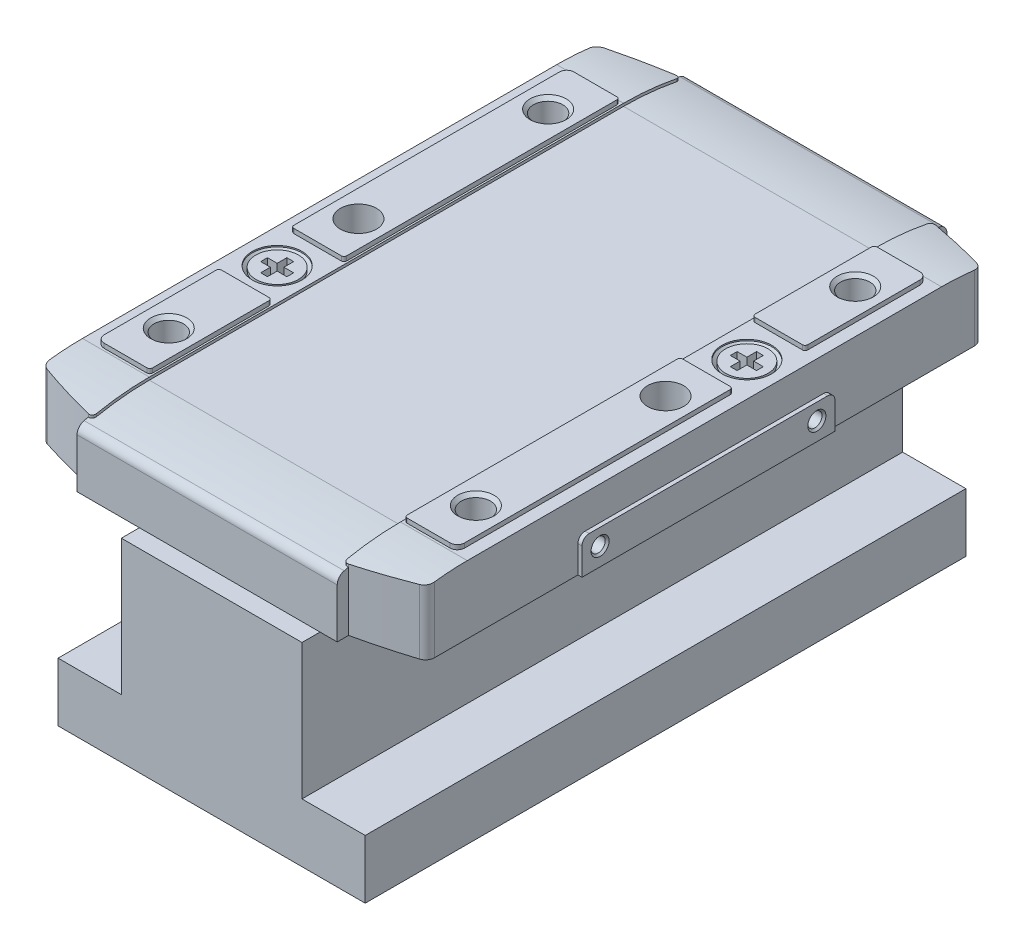
from build123d import *

# Parameters (mm, degrees)
BOSS_EXTRUDE1_DEPTH      = 33.25
BOSS_EXTRUDE1_DEPTH_BACK = 33.25
BOSS_EXTRUDE2_DEPTH      = 20
BOSS_EXTRUDE2_DEPTH_BACK = 20
SKETCH2_W                = 16
SKETCH2_H                = 2.94
BOSS_EXTRUDE3_DEPTH      = 5
BOSS_EXTRUDE4_DEPTH      = 5
BOSS_EXTRUDE5_DEPTH      = 12.5
BOSS_EXTRUDE5_DEPTH_BACK = 12.5
BOSS_EXTRUDE6_DEPTH      = 12.5
BOSS_EXTRUDE6_DEPTH_BACK = 12.5
CUT_EXTRUDE1_DEPTH       = 33.75
CUT_EXTRUDE1_DEPTH_BACK  = 33.75
SKETCH7_W                = 26
SKETCH7_H                = 0.1
BOSS_EXTRUDE7_DEPTH      = 14.4
BOSS_EXTRUDE7_DEPTH_BACK = 14.4
BOSS_EXTRUDE8_DEPTH      = 7.5
BOSS_EXTRUDE9_DEPTH      = 7.5
CUT_EXTRUDE2_DEPTH       = 30
CUT_EXTRUDE2_DEPTH_BACK  = 30
BOSS_EXTRUDE10_DEPTH     = 5
BOSS_EXTRUDE11_DEPTH     = 5
BOSS_EXTRUDE12_DEPTH     = 5
BOSS_EXTRUDE13_DEPTH     = 5
SKETCH16_W               = 2
SKETCH16_H               = 3.1
LPATTERN1_COUNT          = 2
LPATTERN1_PITCH          = 34
LPATTERN2_COUNT          = 2
LPATTERN2_PITCH          = 42
LPATTERN3_COUNT          = 2
LPATTERN3_PITCH          = 42
BOSS_EXTRUDE14_DEPTH     = 0.45
BOSS_EXTRUDE15_START     = -0.45
BOSS_EXTRUDE15_DEPTH     = 0.45
LPATTERN4_COUNT          = 2
LPATTERN4_PITCH          = 24
LPATTERN5_COUNT          = 2
LPATTERN5_PITCH          = 24
CUT_EXTRUDE3_DEPTH       = 0.375
CUT_EXTRUDE3_DEPTH_BACK  = 0.375
SKETCH29_W               = 2.9
SKETCH29_H               = 1.7
CUT_EXTRUDE4_DEPTH       = 0.375
CUT_EXTRUDE4_DEPTH_BACK  = 0.375
SKETCH30_W               = 2.9
SKETCH30_H               = 1.7
CUT_EXTRUDE5_DEPTH       = 0.375
CUT_EXTRUDE5_DEPTH_BACK  = 0.375
SKETCH32_W               = 2.9
SKETCH32_H               = 1.7
CUT_EXTRUDE6_DEPTH       = 0.375
CUT_EXTRUDE6_DEPTH_BACK  = 0.375
SKETCH33_W               = 2.9
SKETCH33_H               = 1.7


with BuildPart() as part:
    # Sketch1 → Boss-Extrude1 (new, two sides: drawn at the far end of the back side and taken through both)
    with BuildSketch(Plane.XY.offset(-BOSS_EXTRUDE1_DEPTH_BACK)):
        Polygon((-17, 6.5), (-17, 0), (17, 0), (17, 6.5), (10, 6.5), (10, 21.5), (-10, 21.5), (-10, 6.5), align=None)
    extrude(amount=BOSS_EXTRUDE1_DEPTH + BOSS_EXTRUDE1_DEPTH_BACK)

    # Sketch2 → Boss-Extrude2 (add, two sides: drawn at the far end of the back side and taken through both)
    with BuildSketch(Plane.XY.offset(-BOSS_EXTRUDE2_DEPTH_BACK)):
        with Locations((0, 22.97)):
            Rectangle(SKETCH2_W, SKETCH2_H)
    extrude(amount=BOSS_EXTRUDE2_DEPTH + BOSS_EXTRUDE2_DEPTH_BACK)

    # Sketch3 → Boss-Extrude3 (add)
    with BuildSketch(Plane.XY.offset(28.75)):
        Polygon((-13.4, 22.4), (-8, 22.4), (-8, 21.5), (8, 21.5), (8, 22.4), (13.4, 22.4), (13.4, 22.85), (-13.4, 22.85), align=None)
    extrude(amount=-BOSS_EXTRUDE3_DEPTH)

    # Sketch4 → Boss-Extrude4 (add)
    with BuildSketch(Plane.XY.offset(-28.75)):
        Polygon((-13.4, 22.4), (-8, 22.4), (-8, 21.5), (8, 21.5), (8, 22.4), (13.4, 22.4), (13.4, 22.85), (-13.4, 22.85), align=None)
    extrude(amount=BOSS_EXTRUDE4_DEPTH)

    # Sketch5 → Boss-Extrude5 (add, two sides: drawn at the far end of the back side and taken through both)
    with BuildSketch(Plane(origin=(0, 0, 0), x_dir=(0, 0, -1), z_dir=(1, 0, 0)).offset(-BOSS_EXTRUDE5_DEPTH_BACK)):
        with BuildLine():
            Line((28.75, 22.66), (28.75, 24.44))
            ThreePointArc((28.75, 24.44), (23.724272164, 24.990406715), (18.936803962, 26.615533185))
            Line((18.936803962, 26.615533185), (18.184543456, 25.002305324))
            ThreePointArc((18.184543456, 25.002305324), (23.339009652, 23.252599822), (28.75, 22.66))
        make_face()
    extrude(amount=BOSS_EXTRUDE5_DEPTH + BOSS_EXTRUDE5_DEPTH_BACK)

    # Sketch6 → Boss-Extrude6 (add, two sides: drawn at the far end of the back side and taken through both)
    with BuildSketch(Plane(origin=(0, 0, 0), x_dir=(0, 0, -1), z_dir=(1, 0, 0)).offset(-BOSS_EXTRUDE6_DEPTH_BACK)):
        with BuildLine():
            Line((-18.184543456, 25.002305324), (-18.936803962, 26.615533185))
            ThreePointArc((-18.936803962, 26.615533185), (-23.724272164, 24.990406715), (-28.75, 24.44))
            Line((-28.75, 24.44), (-28.75, 22.66))
            ThreePointArc((-28.75, 22.66), (-23.339009652, 23.252599822), (-18.184543456, 25.002305324))
        make_face()
    extrude(amount=BOSS_EXTRUDE6_DEPTH + BOSS_EXTRUDE6_DEPTH_BACK)

    # Sketch7 → Cut-Extrude1 (cut, two sides: drawn at the far end of the back side and taken through both)
    with BuildSketch(Plane.XY.offset(-CUT_EXTRUDE1_DEPTH_BACK)):
        with Locations((0, 22.61)):
            Rectangle(SKETCH7_W, SKETCH7_H)
    extrude(amount=CUT_EXTRUDE1_DEPTH + CUT_EXTRUDE1_DEPTH_BACK, mode=Mode.SUBTRACT)

    # Sketch8 → Boss-Extrude7 (add, two sides: drawn at the far end of the back side and taken through both)
    with BuildSketch(Plane(origin=(0, 0, 0), x_dir=(0, 0, -1), z_dir=(1, 0, 0)).offset(-BOSS_EXTRUDE7_DEPTH_BACK)):
        with BuildLine():
            Line((-33.75, 29.462165522), (-33.75, 24))
            Line((-33.75, 24), (33.75, 24))
            Line((33.75, 24), (33.75, 29.462165522))
            ThreePointArc((33.75, 29.462165522), (33.532348366, 30.085006621), (32.974137931, 30.436722954))
            ThreePointArc((32.974137931, 30.436722954), (29.633660103, 31.008569981), (26.25, 31.2))
            Line((26.25, 31.2), (-26.25, 31.2))
            ThreePointArc((-26.25, 31.2), (-29.633660103, 31.008569981), (-32.974137931, 30.436722954))
            ThreePointArc((-32.974137931, 30.436722954), (-33.532348366, 30.085006621), (-33.75, 29.462165522))
        make_face()
    extrude(amount=BOSS_EXTRUDE7_DEPTH + BOSS_EXTRUDE7_DEPTH_BACK)

    # Sketch9 → Boss-Extrude8 (add)
    with BuildSketch(Plane(origin=(0, 24, 0), x_dir=(1, 0, 0), z_dir=(0, 1, 0))):
        with BuildLine():
            Line((21.3, -29.875824116), (21.3, 29.875824116))
            ThreePointArc((21.3, 29.875824116), (21.107856162, 30.465203808), (20.605263158, 30.828092148))
            ThreePointArc((20.605263158, 30.828092148), (17.515198934, 31.737942185), (14.385245902, 32.499334343))
            ThreePointArc((14.385245902, 32.499334343), (14.049099981, 32.420050648), (13.9, 32.108523473))
            Line((13.9, 32.108523473), (13.9, -32.108523473))
            ThreePointArc((13.9, -32.108523473), (14.049099981, -32.420050648), (14.385245902, -32.499334343))
            ThreePointArc((14.385245902, -32.499334343), (17.515198934, -31.737942185), (20.605263158, -30.828092148))
            ThreePointArc((20.605263158, -30.828092148), (21.107856162, -30.465203808), (21.3, -29.875824116))
        make_face()
    extrude(amount=BOSS_EXTRUDE8_DEPTH)

    # Sketch10 → Boss-Extrude9 (add)
    with BuildSketch(Plane(origin=(0, 24, 0), x_dir=(1, 0, 0), z_dir=(0, 1, 0))):
        with BuildLine():
            Line((-21.3, 29.875824116), (-21.3, -29.875824116))
            ThreePointArc((-21.3, -29.875824116), (-21.107856162, -30.465203808), (-20.605263158, -30.828092148))
            ThreePointArc((-20.605263158, -30.828092148), (-17.515198934, -31.737942185), (-14.385245902, -32.499334343))
            ThreePointArc((-14.385245902, -32.499334343), (-14.049099981, -32.420050648), (-13.9, -32.108523473))
            Line((-13.9, -32.108523473), (-13.9, 32.108523473))
            ThreePointArc((-13.9, 32.108523473), (-14.049099981, 32.420050648), (-14.385245902, 32.499334343))
            ThreePointArc((-14.385245902, 32.499334343), (-17.515198934, 31.737942185), (-20.605263158, 30.828092148))
            ThreePointArc((-20.605263158, 30.828092148), (-21.107856162, 30.465203808), (-21.3, 29.875824116))
        make_face()
    extrude(amount=BOSS_EXTRUDE9_DEPTH)

    # Sketch11 → Cut-Extrude2 (cut, two sides: drawn at the far end of the back side and taken through both)
    with BuildSketch(Plane(origin=(0, 0, 0), x_dir=(0, 0, -1), z_dir=(1, 0, 0)).offset(-CUT_EXTRUDE2_DEPTH_BACK)):
        with BuildLine():
            Line((-43.75, 28), (-33.75, 28))
            Line((-33.75, 28), (-33.75, 30.547375097))
            ThreePointArc((-33.75, 30.547375097), (-30.030128774, 31.260890888), (-26.25, 31.5))
            Line((-26.25, 31.5), (26.25, 31.5))
            ThreePointArc((26.25, 31.5), (30.030128774, 31.260890888), (33.75, 30.547375097))
            Line((33.75, 30.547375097), (33.75, 28))
            Line((33.75, 28), (43.75, 28))
            Line((43.75, 28), (43.75, 35))
            Line((43.75, 35), (-43.75, 35))
            Line((-43.75, 35), (-43.75, 28))
        make_face()
    extrude(amount=CUT_EXTRUDE2_DEPTH + CUT_EXTRUDE2_DEPTH_BACK, mode=Mode.SUBTRACT)

    # Sketch12 → Boss-Extrude10 (add)
    with BuildSketch(Plane(origin=(0, 32, 0), x_dir=(1, 0, 0), z_dir=(0, 1, 0))):
        with BuildLine():
            Line((14.1, 4.2), (14.1, -25.7))
            ThreePointArc((14.1, -25.7), (14.187867966, -25.912132034), (14.4, -26))
            Line((14.4, -26), (19.15, -26))
            ThreePointArc((19.15, -26), (19.715685425, -25.765685425), (19.95, -25.2))
            Line((19.95, -25.2), (19.95, 4.2))
            ThreePointArc((19.95, 4.2), (19.862132034, 4.412132034), (19.65, 4.5))
            Line((19.65, 4.5), (14.4, 4.5))
            ThreePointArc((14.4, 4.5), (14.187867966, 4.412132034), (14.1, 4.2))
        make_face()
    extrude(amount=-BOSS_EXTRUDE10_DEPTH)

    # Sketch13 → Boss-Extrude11 (add)
    with BuildSketch(Plane(origin=(0, 32, 0), x_dir=(1, 0, 0), z_dir=(0, 1, 0))):
        with BuildLine():
            Line((-19.65, -4.5), (-14.4, -4.5))
            ThreePointArc((-14.4, -4.5), (-14.187867966, -4.412132034), (-14.1, -4.2))
            Line((-14.1, -4.2), (-14.1, 25.7))
            ThreePointArc((-14.1, 25.7), (-14.187867966, 25.912132034), (-14.4, 26))
            Line((-14.4, 26), (-19.15, 26))
            ThreePointArc((-19.15, 26), (-19.715685425, 25.765685425), (-19.95, 25.2))
            Line((-19.95, 25.2), (-19.95, -4.2))
            ThreePointArc((-19.95, -4.2), (-19.862132034, -4.412132034), (-19.65, -4.5))
        make_face()
    extrude(amount=-BOSS_EXTRUDE11_DEPTH)

    # Sketch14 → Boss-Extrude12 (add)
    with BuildSketch(Plane(origin=(0, 32, 0), x_dir=(1, 0, 0), z_dir=(0, 1, 0))):
        with BuildLine():
            Line((14.1, 25.7), (14.1, 12.8))
            ThreePointArc((14.1, 12.8), (14.187867966, 12.587867966), (14.4, 12.5))
            Line((14.4, 12.5), (19.65, 12.5))
            ThreePointArc((19.65, 12.5), (19.862132034, 12.587867966), (19.95, 12.8))
            Line((19.95, 12.8), (19.95, 25.2))
            ThreePointArc((19.95, 25.2), (19.715685425, 25.765685425), (19.15, 26))
            Line((19.15, 26), (14.4, 26))
            ThreePointArc((14.4, 26), (14.187867966, 25.912132034), (14.1, 25.7))
        make_face()
    extrude(amount=-BOSS_EXTRUDE12_DEPTH)

    # Sketch15 → Boss-Extrude13 (add)
    with BuildSketch(Plane(origin=(0, 32, 0), x_dir=(1, 0, 0), z_dir=(0, 1, 0))):
        with BuildLine():
            Line((-19.15, -26), (-14.4, -26))
            ThreePointArc((-14.4, -26), (-14.187867966, -25.912132034), (-14.1, -25.7))
            Line((-14.1, -25.7), (-14.1, -12.8))
            ThreePointArc((-14.1, -12.8), (-14.187867966, -12.587867966), (-14.4, -12.5))
            Line((-14.4, -12.5), (-19.65, -12.5))
            ThreePointArc((-19.65, -12.5), (-19.862132034, -12.587867966), (-19.95, -12.8))
            Line((-19.95, -12.8), (-19.95, -25.2))
            ThreePointArc((-19.95, -25.2), (-19.715685425, -25.765685425), (-19.15, -26))
        make_face()
    extrude(amount=-BOSS_EXTRUDE13_DEPTH)

    # Sketch16 → Cut-Revolve1 (revolve, cut)
    with BuildSketch(Plane.XY):
        with Locations((18, 30.45)):
            Rectangle(SKETCH16_W, SKETCH16_H)
    cut_revolve1 = revolve(axis=Axis((17, 28.9, 0), (0, 1, 0)), mode=Mode.SUBTRACT)

    # LPattern1: Cut-Revolve1 ×2
    with Locations(*[(-i * LPATTERN1_PITCH, 0, 0) for i in range(1, LPATTERN1_COUNT)]):
        add(cut_revolve1, mode=Mode.SUBTRACT)

    # Sketch18 → Cut-Revolve2 (revolve, cut)
    with BuildSketch(Plane(origin=(17, 0, 0), x_dir=(0, 0, -1), z_dir=(1, 0, 0))):
        Polygon((-21, 32), (-19, 32), (-19.379, 31.621), (-19.379, 24), (-21, 24), align=None)
    cut_revolve2 = revolve(axis=Axis((17, 24, 21), (0, 1, 0)), mode=Mode.SUBTRACT)

    # LPattern2: Cut-Revolve2 ×2
    with Locations(*[(0, 0, -i * LPATTERN2_PITCH) for i in range(1, LPATTERN2_COUNT)]):
        add(cut_revolve2, mode=Mode.SUBTRACT)

    # Sketch20 → Cut-Revolve3 (revolve, cut)
    with BuildSketch(Plane(origin=(-17, 0, 0), x_dir=(0, 0, -1), z_dir=(1, 0, 0))):
        Polygon((-21, 32), (-19, 32), (-19.379, 31.621), (-19.379, 24), (-21, 24), align=None)
    cut_revolve3 = revolve(axis=Axis((-17, 24, 21), (0, 1, 0)), mode=Mode.SUBTRACT)

    # LPattern3: Cut-Revolve3 ×2
    with Locations(*[(0, 0, -i * LPATTERN3_PITCH) for i in range(1, LPATTERN3_COUNT)]):
        add(cut_revolve3, mode=Mode.SUBTRACT)

    # Sketch22 → Boss-Extrude14 (add)
    with BuildSketch(Plane(origin=(21.3, 0, 0), x_dir=(0, 0, -1), z_dir=(1, 0, 0))):
        with BuildLine():
            Line((-14, 27), (-14, 24))
            Line((-14, 24), (14, 24))
            Line((14, 24), (14, 27))
            ThreePointArc((14, 27), (13.765685425, 27.565685425), (13.2, 27.8))
            Line((13.2, 27.8), (-13.2, 27.8))
            ThreePointArc((-13.2, 27.8), (-13.765685425, 27.565685425), (-14, 27))
        make_face()
    extrude(amount=BOSS_EXTRUDE14_DEPTH)

    # Sketch23 → Boss-Extrude15 (add)
    with BuildSketch(Plane(origin=(-21.3, 0, 0), x_dir=(0, 0, -1), z_dir=(1, 0, 0)).offset(BOSS_EXTRUDE15_START)):
        with BuildLine():
            Line((-14, 27), (-14, 24))
            Line((-14, 24), (14, 24))
            Line((14, 24), (14, 27))
            ThreePointArc((14, 27), (13.765685425, 27.565685425), (13.2, 27.8))
            Line((13.2, 27.8), (-13.2, 27.8))
            ThreePointArc((-13.2, 27.8), (-13.765685425, 27.565685425), (-14, 27))
        make_face()
    extrude(amount=BOSS_EXTRUDE15_DEPTH)

    # Sketch24 → Cut-Revolve4 (revolve, cut)
    with BuildSketch(Plane(origin=(0, 26, 0), x_dir=(1, 0, 0), z_dir=(0, 1, 0))):
        Polygon((21.75, -12), (21.75, -13), (21.5335, -12.7835), (15.75, -12.7835), (15.75, -12), align=None)
    cut_revolve4 = revolve(axis=Axis((15.75, 26, 12), (1, 0, 0)), mode=Mode.SUBTRACT)

    # LPattern4: Cut-Revolve4 ×2
    with Locations(*[(0, 0, -i * LPATTERN4_PITCH) for i in range(1, LPATTERN4_COUNT)]):
        add(cut_revolve4, mode=Mode.SUBTRACT)

    # Sketch26 → Cut-Revolve5 (revolve, cut)
    with BuildSketch(Plane(origin=(0, 26, 0), x_dir=(1, 0, 0), z_dir=(0, 1, 0))):
        Polygon((-15.75, -12), (-15.75, -12.7835), (-21.5335, -12.7835), (-21.75, -13), (-21.75, -12), align=None)
    cut_revolve5 = revolve(axis=Axis((-21.75, 26, 12), (1, 0, 0)), mode=Mode.SUBTRACT)

    # LPattern5: Cut-Revolve5 ×2
    with Locations(*[(0, 0, -i * LPATTERN5_PITCH) for i in range(1, LPATTERN5_COUNT)]):
        add(cut_revolve5, mode=Mode.SUBTRACT)

    # Sketch28 → Cut-Revolve6 (revolve, cut)
    with BuildSketch(Plane(origin=(17.5, 0, 0), x_dir=(0, 0, -1), z_dir=(1, 0, 0))):
        Polygon((8.5, 31.5), (11.25, 31.5), (11.25, 31.355), (10.85, 31), (10.85, 31.355), (8.5, 31.355), align=None)
    revolve(axis=Axis((17.5, 31.355, -8.5), (0, 1, 0)), mode=Mode.SUBTRACT)

    # Sketch29 → Cut-Extrude3 (cut, two sides: drawn at the far end of the back side and taken through both)
    with BuildSketch(Plane(origin=(17.5, 0, 0), x_dir=(0, 0, -1), z_dir=(1, 0, 0)).offset(-CUT_EXTRUDE3_DEPTH_BACK)):
        with Locations((8.5, 30.65)):
            Rectangle(SKETCH29_W, SKETCH29_H)
    extrude(amount=CUT_EXTRUDE3_DEPTH + CUT_EXTRUDE3_DEPTH_BACK, mode=Mode.SUBTRACT)

    # Sketch30 → Cut-Extrude4 (cut, two sides: drawn at the far end of the back side and taken through both)
    with BuildSketch(Plane.XY.offset(-8.5).offset(-CUT_EXTRUDE4_DEPTH_BACK)):
        with Locations((17.5, 30.65)):
            Rectangle(SKETCH30_W, SKETCH30_H)
    extrude(amount=CUT_EXTRUDE4_DEPTH + CUT_EXTRUDE4_DEPTH_BACK, mode=Mode.SUBTRACT)

    # Sketch31 → Cut-Revolve7 (revolve, cut)
    with BuildSketch(Plane(origin=(-17.5, 0, 0), x_dir=(0, 0, -1), z_dir=(1, 0, 0))):
        Polygon((-8.5, 31.5), (-5.75, 31.5), (-5.75, 31.355), (-6.15, 31), (-6.15, 31.355), (-8.5, 31.355), align=None)
    revolve(axis=Axis((-17.5, 31.355, 8.5), (0, 1, 0)), mode=Mode.SUBTRACT)

    # Sketch32 → Cut-Extrude5 (cut, two sides: drawn at the far end of the back side and taken through both)
    with BuildSketch(Plane(origin=(-17.5, 0, 0), x_dir=(0, 0, -1), z_dir=(1, 0, 0)).offset(-CUT_EXTRUDE5_DEPTH_BACK)):
        with Locations((-8.5, 30.65)):
            Rectangle(SKETCH32_W, SKETCH32_H)
    extrude(amount=CUT_EXTRUDE5_DEPTH + CUT_EXTRUDE5_DEPTH_BACK, mode=Mode.SUBTRACT)

    # Sketch33 → Cut-Extrude6 (cut, two sides: drawn at the far end of the back side and taken through both)
    with BuildSketch(Plane.XY.offset(8.5).offset(-CUT_EXTRUDE6_DEPTH_BACK)):
        with Locations((-17.5, 30.65)):
            Rectangle(SKETCH33_W, SKETCH33_H)
    extrude(amount=CUT_EXTRUDE6_DEPTH + CUT_EXTRUDE6_DEPTH_BACK, mode=Mode.SUBTRACT)


solid = part.part
